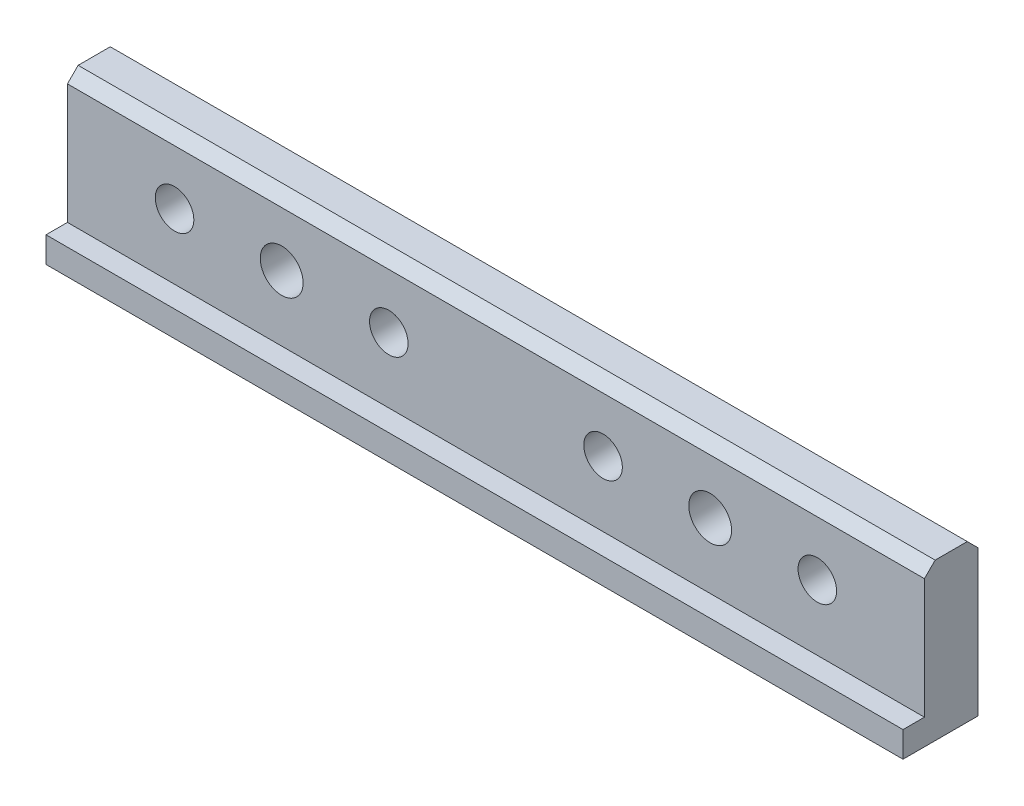
from build123d import *

# Parameters (mm, degrees)
SKETCH_1_W          = 400
SKETCH_1_H          = 80
EXTRUDE_1_DEPTH     = 35
SKETCH_2_W          = 400
SKETCH_2_H          = 61
CUT_EXTRUDE_1_DEPTH = 10
CHAMFER_1_SIZE      = 5
CHAMFER_2_SIZE      = 10
CHAMFER_2_SIZE2     = 7.002075382
CHAMFER_3_SIZE      = 10
CHAMFER_3_SIZE2     = 7.002075382
CHAMFER_4_SIZE      = 10
CHAMFER_4_SIZE2     = 7.002075382
CHAMFER_5_SIZE      = 10
CHAMFER_5_SIZE2     = 7.002075382
CUT_EXTRUDE_2_REACH = 207.487
SKETCH_3_R          = 9
SKETCH_3_R_2        = 10


with BuildPart() as part:
    # 草图1 → 凸台-拉伸1 (new body)
    with BuildSketch(Plane.XY):
        Rectangle(SKETCH_1_W, SKETCH_1_H)
    extrude(amount=EXTRUDE_1_DEPTH)

    # 草图2 → 切除-拉伸1 (cut)
    with BuildSketch(Plane.XY.offset(35)):
        with Locations((0, 9.5)):
            Rectangle(SKETCH_2_W, SKETCH_2_H)
    extrude(amount=-CUT_EXTRUDE_1_DEPTH, mode=Mode.SUBTRACT)

    # 倒角1
    chamfer_1_edges = [part.edges().sort_by_distance(p)[0] for p in [
        (0, 40, 25),
        (0, 40, 0),
    ]]
    chamfer(chamfer_1_edges, length=CHAMFER_1_SIZE)

    # 倒角2
    chamfer_2_edges = [part.edges().sort_by_distance(p)[0] for p in [
        (0, -40, 35),
    ]]
    chamfer_2_side = [part.faces().sort_by_distance(p)[0] for p in [
        (0, -40, 17.5),
    ]]
    chamfer(chamfer_2_edges, length=CHAMFER_2_SIZE, length2=CHAMFER_2_SIZE2, reference=chamfer_2_side[0])

    # 倒角3
    chamfer_3_edges = [part.edges().sort_by_distance(p)[0] for p in [
        (0, -40, 0),
    ]]
    chamfer_3_side = [part.faces().sort_by_distance(p)[0] for p in [
        (0, -40, 12.5),
    ]]
    chamfer(chamfer_3_edges, length=CHAMFER_3_SIZE, length2=CHAMFER_3_SIZE2, reference=chamfer_3_side[0])

    # 倒角4
    chamfer_4_edges = [part.edges().sort_by_distance(p)[0] for p in [
        (-200, -40, 17.5),
    ]]
    chamfer_4_side = [part.faces().sort_by_distance(p)[0] for p in [
        (0, -40, 17.5),
    ]]
    chamfer(chamfer_4_edges, length=CHAMFER_4_SIZE, length2=CHAMFER_4_SIZE2, reference=chamfer_4_side[0])

    # 倒角5
    chamfer_5_edges = [part.edges().sort_by_distance(p)[0] for p in [
        (200, -40, 17.5),
    ]]
    chamfer_5_side = [part.faces().sort_by_distance(p)[0] for p in [
        (5, -40, 17.5),
    ]]
    chamfer(chamfer_5_edges, length=CHAMFER_5_SIZE, length2=CHAMFER_5_SIZE2, reference=chamfer_5_side[0])

    # 草图3 → 切除-拉伸2 (cut, up to next)
    with BuildSketch(Plane.XY.offset(25), mode=Mode.PRIVATE) as cut_extrude_2_sk1:
        with Locations((-150, 9.5)):
            Circle(SKETCH_3_R)
    cut_extrude_2_tool1 = extrude(cut_extrude_2_sk1.sketch, amount=-CUT_EXTRUDE_2_REACH, mode=Mode.PRIVATE) & part.part
    # 草图3 → 切除-拉伸2 (cut, up to next)
    with BuildSketch(Plane.XY.offset(25), mode=Mode.PRIVATE) as cut_extrude_2_sk2:
        with Locations((-100, 9.5)):
            Circle(SKETCH_3_R_2)
    cut_extrude_2_tool2 = extrude(cut_extrude_2_sk2.sketch, amount=-CUT_EXTRUDE_2_REACH, mode=Mode.PRIVATE) & part.part
    # 草图3 → 切除-拉伸2 (cut, up to next)
    with BuildSketch(Plane.XY.offset(25), mode=Mode.PRIVATE) as cut_extrude_2_sk3:
        with Locations((-50, 9.5)):
            Circle(SKETCH_3_R)
    cut_extrude_2_tool3 = extrude(cut_extrude_2_sk3.sketch, amount=-CUT_EXTRUDE_2_REACH, mode=Mode.PRIVATE) & part.part
    # 草图3 → 切除-拉伸2 (cut, up to next)
    with BuildSketch(Plane.XY.offset(25), mode=Mode.PRIVATE) as cut_extrude_2_sk4:
        with Locations((50, 9.5)):
            Circle(SKETCH_3_R)
    cut_extrude_2_tool4 = extrude(cut_extrude_2_sk4.sketch, amount=-CUT_EXTRUDE_2_REACH, mode=Mode.PRIVATE) & part.part
    # 草图3 → 切除-拉伸2 (cut, up to next)
    with BuildSketch(Plane.XY.offset(25), mode=Mode.PRIVATE) as cut_extrude_2_sk5:
        with Locations((100, 9.5)):
            Circle(SKETCH_3_R_2)
    cut_extrude_2_tool5 = extrude(cut_extrude_2_sk5.sketch, amount=-CUT_EXTRUDE_2_REACH, mode=Mode.PRIVATE) & part.part
    # 草图3 → 切除-拉伸2 (cut, up to next)
    with BuildSketch(Plane.XY.offset(25), mode=Mode.PRIVATE) as cut_extrude_2_sk6:
        with Locations((150, 9.5)):
            Circle(SKETCH_3_R)
    cut_extrude_2_tool6 = extrude(cut_extrude_2_sk6.sketch, amount=-CUT_EXTRUDE_2_REACH, mode=Mode.PRIVATE) & part.part
    add(cut_extrude_2_tool1.solids().sort_by_distance((-150, 9.5, 25))[0], mode=Mode.SUBTRACT)
    add(cut_extrude_2_tool2.solids().sort_by_distance((-100, 9.5, 25))[0], mode=Mode.SUBTRACT)
    add(cut_extrude_2_tool3.solids().sort_by_distance((-50, 9.5, 25))[0], mode=Mode.SUBTRACT)
    add(cut_extrude_2_tool4.solids().sort_by_distance((50, 9.5, 25))[0], mode=Mode.SUBTRACT)
    add(cut_extrude_2_tool5.solids().sort_by_distance((100, 9.5, 25))[0], mode=Mode.SUBTRACT)
    add(cut_extrude_2_tool6.solids().sort_by_distance((150, 9.5, 25))[0], mode=Mode.SUBTRACT)


solid = part.part
